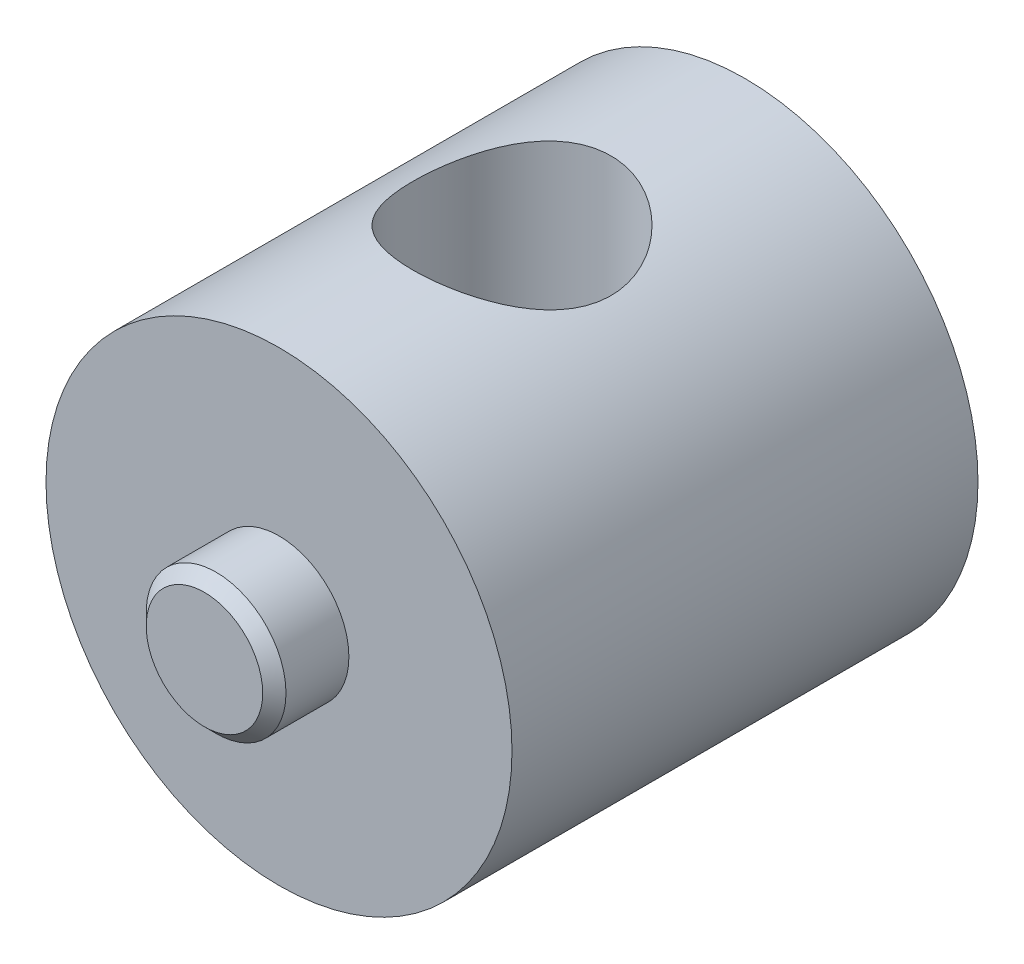
from build123d import *

# Parameters (mm, degrees)
SCHIZZO1_R                   = 10
ESTRUSIONE_ESTRUSIONE1_DEPTH = 20
SCHIZZO2_R                   = 3
ESTRUSIONE_ESTRUSIONE2_DEPTH = 13.2
SMUSSO1_SIZE                 = 0.5
FORO_FILETTATO_M10_3_D       = 8.5


with BuildPart() as part:
    # Schizzo1 → Estrusione-Estrusione1 (new body)
    with BuildSketch(Plane.XY):
        Circle(SCHIZZO1_R)
    extrude(amount=ESTRUSIONE_ESTRUSIONE1_DEPTH)

    # Schizzo2 → Estrusione-Estrusione2 (add, symmetric)
    with BuildSketch(Plane.XY.offset(10)):
        Circle(SCHIZZO2_R)
    extrude(amount=ESTRUSIONE_ESTRUSIONE2_DEPTH, both=True)

    # Smusso1
    smusso1_edges = [part.edges().sort_by_distance(p)[0] for p in [
        (-3, 0, -3.2),
        (-3, 0, 23.2),
    ]]
    chamfer(smusso1_edges, length=SMUSSO1_SIZE)

    # Foro filettato M10-3 (through all)
    with Locations(Plane(origin=(0, 10, 10), x_dir=(1, 0, 0), z_dir=(0, 1, 0))):
        with Locations((0, 0)):
            Hole(FORO_FILETTATO_M10_3_D / 2)


solid = part.part
